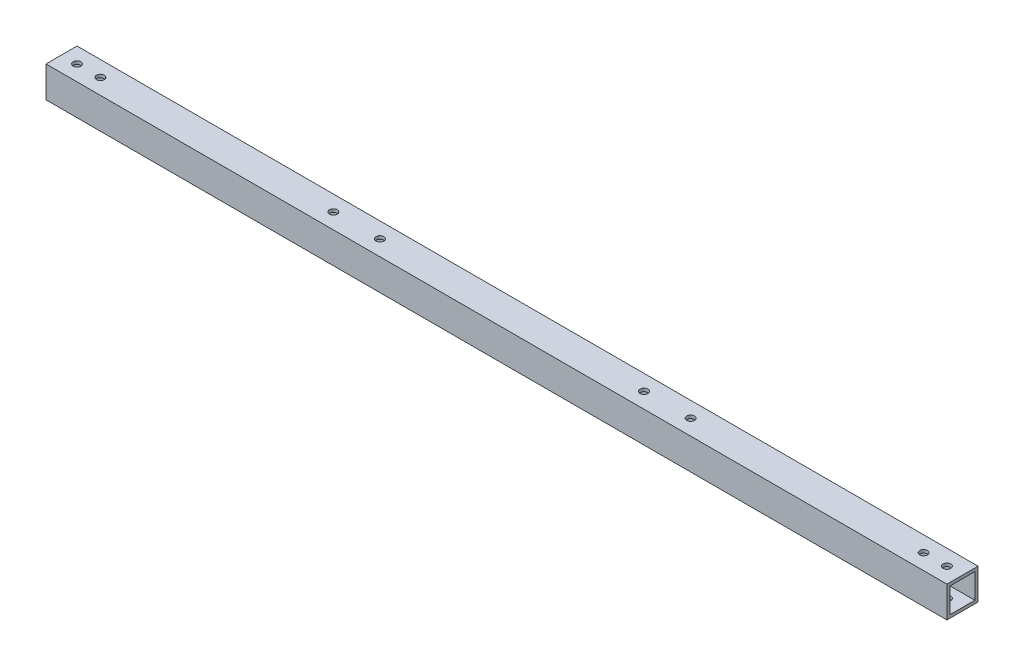
from build123d import *

# Parameters (mm, degrees)
SKETCH1_W           = 20
SKETCH1_H           = 20
SKETCH1_W_2         = 16
SKETCH1_H_2         = 16
BOSS_EXTRUDE1_DEPTH = 580
SKETCH2_R           = 2.5
CUT_EXTRUDE1_DEPTH  = 581.430874437
SKETCH3_R           = 2.5
CUT_EXTRUDE2_DEPTH  = 581.430874437


with BuildPart() as part:
    # Sketch1 → Boss-Extrude1 (new body)
    with BuildSketch(Plane(origin=(0, 0, 0), x_dir=(0, 0, -1), z_dir=(1, 0, 0))):
        Rectangle(SKETCH1_W, SKETCH1_H)
        Rectangle(SKETCH1_W_2, SKETCH1_H_2, mode=Mode.SUBTRACT)
    extrude(amount=BOSS_EXTRUDE1_DEPTH)

    # Sketch2 → Cut-Extrude1 (cut, through all)
    with BuildSketch(Plane(origin=(0, 10, 0), x_dir=(1, 0, 0), z_dir=(0, 1, 0))):
        with Locations(Location((10, 0, 0), (0, 0, 270))):
            Circle(SKETCH2_R)
        with Locations(Location((570, 0, 0), (0, 0, 270))):
            Circle(SKETCH2_R)
        with Locations(Location((25, 0, 0), (0, 0, 270))):
            Circle(SKETCH2_R)
        with Locations(Location((555, 0, 0), (0, 0, 270))):
            Circle(SKETCH2_R)
    extrude(amount=-CUT_EXTRUDE1_DEPTH, mode=Mode.SUBTRACT)

    # Sketch3 → Cut-Extrude2 (cut, through all)
    with BuildSketch(Plane(origin=(0, 10, 0), x_dir=(1, 0, 0), z_dir=(0, 1, 0))):
        with Locations(Location((175, 0, 0), (0, 0, 270))):
            Circle(SKETCH3_R)
        with Locations(Location((405, 0, 0), (0, 0, 270))):
            Circle(SKETCH3_R)
        with Locations(Location((205, 0, 0), (0, 0, 270))):
            Circle(SKETCH3_R)
        with Locations(Location((375, 0, 0), (0, 0, 270))):
            Circle(SKETCH3_R)
    extrude(amount=-CUT_EXTRUDE2_DEPTH, mode=Mode.SUBTRACT)


solid = part.part
